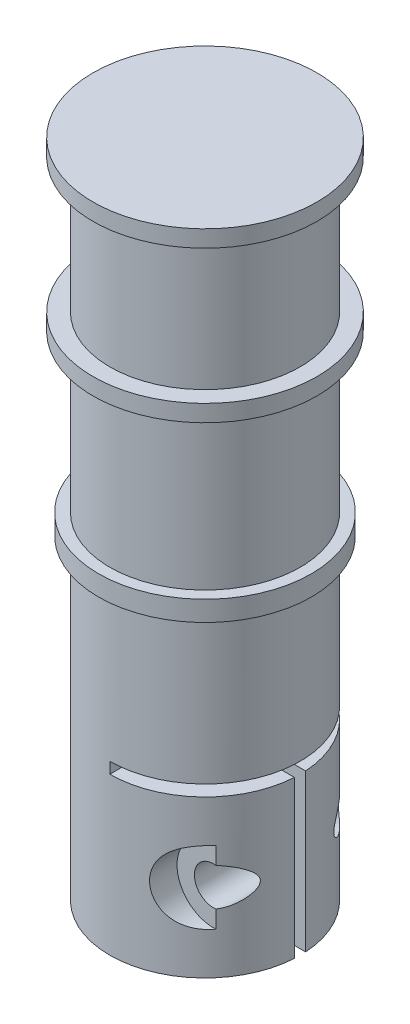
from build123d import *

# Parameters (mm, degrees)
CBORE_FOR_M3_SHCS1_D           = 3.4
CBORE_FOR_M3_SHCS1_DEPTH       = 8.5
CBORE_FOR_M3_SHCS1_CBORE_D     = 6.5
CBORE_FOR_M3_SHCS1_CBORE_DEPTH = 3
M3X0_5_TAPPED_HOLE1_D          = 2.5
CUT_EXTRUDE1_DEPTH             = 47.216880128
CUT_EXTRUDE1_DEPTH_BACK        = 47.216880128
SKETCH10_W                     = 1
SKETCH10_H                     = 15
CUT_EXTRUDE2_DEPTH             = 10


with BuildPart() as part:
    # Sketch1 → Revolve1 (revolve)
    with BuildSketch(Plane.XY):
        Polygon((-8.5, -44), (-8.5, -15.8), (-9.5, -15.8), (-9.5, -14), (-8.5, -14), (-8.5, 0), (-10, 0), (-10, 1.5), (-8.5, 1.5), (-8.5, 13.5), (-10, 13.5), (-10, 15), (0, 15), (0, -30), (-4, -30), (-4, -44), align=None)
    revolve(axis=Axis((0, 15, 0), (0, -1, 0)))

    # CBORE for M3 SHCS1
    with Locations(Plane.XY.offset(8.5)):
        with Locations((6.25, -37)):
            CounterBoreHole(CBORE_FOR_M3_SHCS1_D / 2, CBORE_FOR_M3_SHCS1_CBORE_D / 2, CBORE_FOR_M3_SHCS1_CBORE_DEPTH, depth=CBORE_FOR_M3_SHCS1_DEPTH)

    # M3x0.5 Tapped Hole1 (through all)
    with Locations(Plane.XY):
        with Locations((6.25, -37)):
            Hole(M3X0_5_TAPPED_HOLE1_D / 2)

    # Sketch10 → Cut-Extrude1 (cut, two sides: drawn at the far end of the back side and taken through both)
    with BuildSketch(Plane(origin=(0, 0, 0), x_dir=(0, 0, -1), z_dir=(1, 0, 0)).offset(-CUT_EXTRUDE1_DEPTH_BACK)):
        with Locations((0, -37.5)):
            Rectangle(SKETCH10_W, SKETCH10_H)
    extrude(amount=CUT_EXTRUDE1_DEPTH + CUT_EXTRUDE1_DEPTH_BACK, mode=Mode.SUBTRACT)

    # Sketch10<3> → Cut-Extrude2 (cut)
    with BuildSketch(Plane(origin=(0, 0, 0), x_dir=(0, 0, -1), z_dir=(1, 0, 0))):
        Polygon((-0.5, -30), (0.5, -30), (9.5, -30), (9.5, -29), (-9.5, -29), (-9.5, -30), align=None)
    extrude(amount=CUT_EXTRUDE2_DEPTH, mode=Mode.SUBTRACT)


solid = part.part
